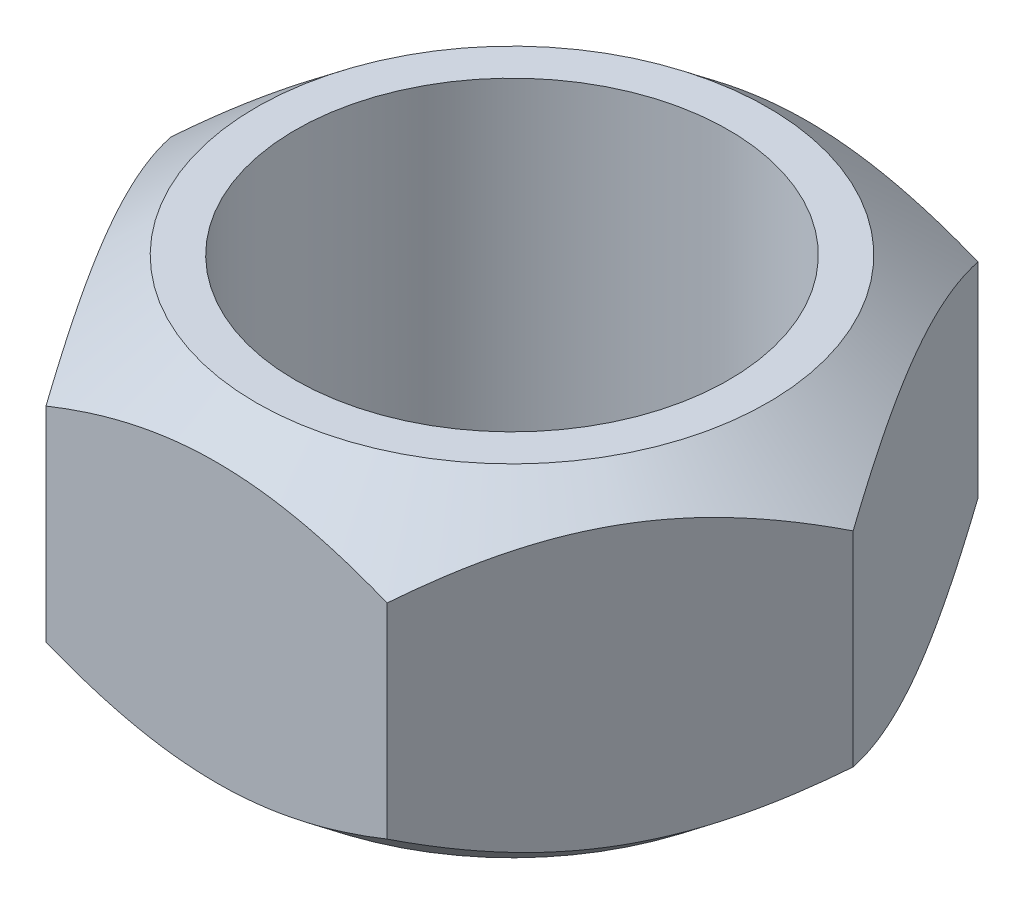
from build123d import *

# Parameters (mm, degrees)
SKETCH1_R           = 6.35
BOSS_EXTRUDE1_DEPTH = 10


with BuildPart() as part:
    # Sketch1 → Boss-Extrude1 (new body)
    with BuildSketch(Plane(origin=(0, 0, 0), x_dir=(1, 0, 0), z_dir=(0, 1, 0))):
        Polygon((10, 0), (5, 8.660254038), (-5, 8.660254038), (-10, 0), (-5, -8.660254038), (5, -8.660254038), align=None)
        with Locations(Location((0, 0, 0), (0, 0, 270))):
            Circle(SKETCH1_R, mode=Mode.SUBTRACT)
    extrude(amount=BOSS_EXTRUDE1_DEPTH)

    # Sketch3 → Cut-Revolve1 (revolve, cut)
    with BuildSketch(Plane.XY, mode=Mode.PRIVATE) as cut_revolve1_sk:
        Polygon((-10, 10), (-10, 7.996913118), (-7.5, 10), align=None)
    cut_revolve1 = revolve(cut_revolve1_sk.sketch.rotate(Axis((0, 10, 0), (0, -1, 0)), 60.000000094), axis=Axis((0, 10, 0), (0, -1, 0)), mode=Mode.SUBTRACT)

    # Mirror1: Cut-Revolve1 across plane
    add(cut_revolve1.mirror(Plane(origin=(0, 5, 0), x_dir=(0, 0, 1), z_dir=(0, -1, 0))), mode=Mode.SUBTRACT)


solid = part.part
